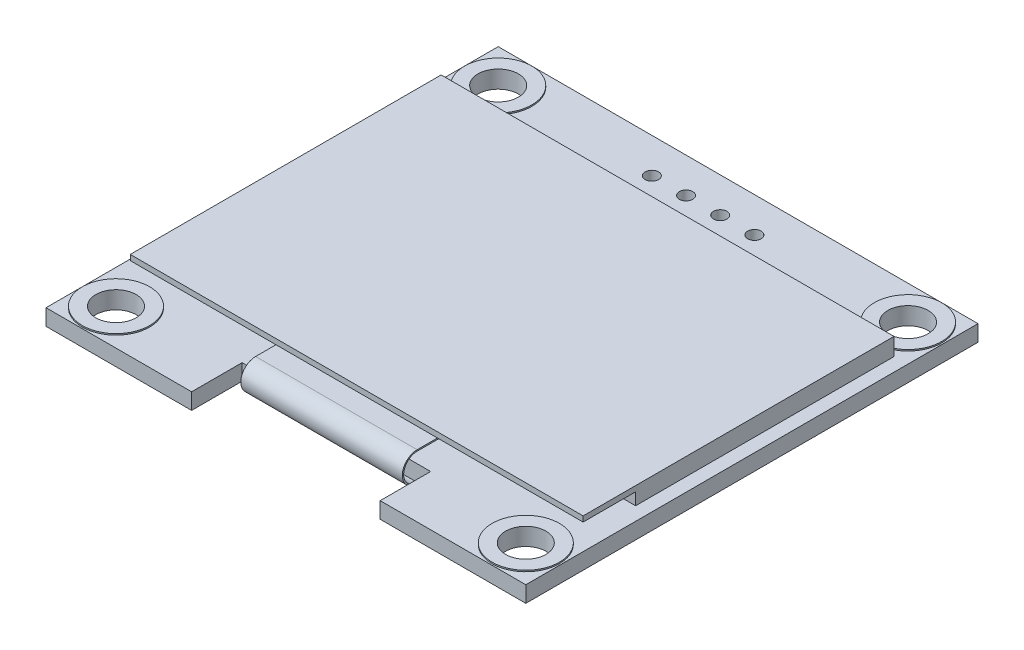
from build123d import *

# Parameters (mm, degrees)
CROQUIS1_R                     = 2.5
CROQUIS1_R_2                   = 0.5
SALIENTE_EXTRUIR1_DEPTH        = 1.2
SALIENTE_EXTRUIR2_DEPTH        = 0.1
SALIENTE_EXTRUIR2_DEPTH_BACK   = 1.2
CROQUIS2_R                     = 2.5
CROQUIS2_R_2                   = 1.5
SALIENTE_EXTRUIR2_2_DEPTH      = 0.1
SALIENTE_EXTRUIR2_2_DEPTH_BACK = 1.2
SALIENTE_EXTRUIR2_3_DEPTH      = 0.1
SALIENTE_EXTRUIR2_3_DEPTH_BACK = 1.2
SALIENTE_EXTRUIR2_4_DEPTH      = 0.1
SALIENTE_EXTRUIR2_4_DEPTH_BACK = 1.2
SALIENTE_EXTRUIR3_DEPTH        = 16.825
SALIENTE_EXTRUIR3_DEPTH_BACK   = 16.825
SALIENTE_EXTRUIR4_DEPTH        = 0.1
SALIENTE_EXTRUIR5_DEPTH        = 6
SALIENTE_EXTRUIR5_DEPTH_BACK   = 6


with BuildPart() as part:
    # Croquis1 → Saliente-Extruir1 (new body)
    with BuildSketch(Plane(origin=(0, 0, 0), x_dir=(1, 0, 0), z_dir=(0, 1, 0))):
        Polygon((-7.005, 0), (7.005, 0), (7.005, -3.75), (17.825, -3.75), (17.825, 29.85), (-17.825, 29.85), (-17.825, -3.75), (-7.005, -3.75), align=None)
        with Locations(Location((-15.225, 27.25, 0), (0, 0, 270))):
            Circle(CROQUIS1_R, mode=Mode.SUBTRACT)
        with Locations(Location((15.225, 27.25, 0), (0, 0, 270))):
            Circle(CROQUIS1_R, mode=Mode.SUBTRACT)
        with Locations(Location((-15.225, -1.15, 0), (0, 0, 270))):
            Circle(CROQUIS1_R, mode=Mode.SUBTRACT)
        with Locations(Location((15.225, -1.15, 0), (0, 0, 270))):
            Circle(CROQUIS1_R, mode=Mode.SUBTRACT)
        with Locations(Location((-1.27, 27.25, 0), (0, 0, 270))):
            Circle(CROQUIS1_R_2, mode=Mode.SUBTRACT)
        with Locations(Location((-3.81, 27.25, 0), (0, 0, 270))):
            Circle(CROQUIS1_R_2, mode=Mode.SUBTRACT)
        with Locations(Location((1.27, 27.25, 0), (0, 0, 270))):
            Circle(CROQUIS1_R_2, mode=Mode.SUBTRACT)
        with Locations(Location((3.81, 27.25, 0), (0, 0, 270))):
            Circle(CROQUIS1_R_2, mode=Mode.SUBTRACT)
    extrude(amount=SALIENTE_EXTRUIR1_DEPTH)


with BuildPart() as body_2:
    # Croquis2 → Saliente-Extruir2 (new, two sides: drawn at the far end of the back side and taken through both)
    with BuildSketch(Plane(origin=(0, 1.2, 0), x_dir=(1, 0, 0), z_dir=(0, 1, 0)).offset(-SALIENTE_EXTRUIR2_DEPTH_BACK)):
        with Locations(Location((-15.225, 27.25, 0), (0, 0, 270))):
            Circle(CROQUIS2_R)
        with Locations(Location((-15.225, 27.25, 0), (0, 0, 270))):
            Circle(CROQUIS2_R_2, mode=Mode.SUBTRACT)
    extrude(amount=SALIENTE_EXTRUIR2_DEPTH + SALIENTE_EXTRUIR2_DEPTH_BACK)


with BuildPart() as body_3:
    # Croquis2 → Saliente-Extruir2 2 (new, two sides: drawn at the far end of the back side and taken through both)
    with BuildSketch(Plane(origin=(0, 1.2, 0), x_dir=(1, 0, 0), z_dir=(0, 1, 0)).offset(-SALIENTE_EXTRUIR2_2_DEPTH_BACK)):
        with Locations(Location((15.225, 27.25, 0), (0, 0, 270))):
            Circle(CROQUIS2_R)
        with Locations(Location((15.225, 27.25, 0), (0, 0, 270))):
            Circle(CROQUIS2_R_2, mode=Mode.SUBTRACT)
    extrude(amount=SALIENTE_EXTRUIR2_2_DEPTH + SALIENTE_EXTRUIR2_2_DEPTH_BACK)


with BuildPart() as body_4:
    # Croquis2 → Saliente-Extruir2 3 (new, two sides: drawn at the far end of the back side and taken through both)
    with BuildSketch(Plane(origin=(0, 1.2, 0), x_dir=(1, 0, 0), z_dir=(0, 1, 0)).offset(-SALIENTE_EXTRUIR2_3_DEPTH_BACK)):
        with Locations(Location((-15.225, -1.15, 0), (0, 0, 270))):
            Circle(CROQUIS2_R)
        with Locations(Location((-15.225, -1.15, 0), (0, 0, 270))):
            Circle(CROQUIS2_R_2, mode=Mode.SUBTRACT)
    extrude(amount=SALIENTE_EXTRUIR2_3_DEPTH + SALIENTE_EXTRUIR2_3_DEPTH_BACK)


with BuildPart() as body_5:
    # Croquis2 → Saliente-Extruir2 4 (new, two sides: drawn at the far end of the back side and taken through both)
    with BuildSketch(Plane(origin=(0, 1.2, 0), x_dir=(1, 0, 0), z_dir=(0, 1, 0)).offset(-SALIENTE_EXTRUIR2_4_DEPTH_BACK)):
        with Locations(Location((15.225, -1.15, 0), (0, 0, 270))):
            Circle(CROQUIS2_R)
        with Locations(Location((15.225, -1.15, 0), (0, 0, 270))):
            Circle(CROQUIS2_R_2, mode=Mode.SUBTRACT)
    extrude(amount=SALIENTE_EXTRUIR2_4_DEPTH + SALIENTE_EXTRUIR2_4_DEPTH_BACK)


with BuildPart() as body_6:
    # Croquis3 → Saliente-Extruir3 (new, two sides: drawn at the far end of the back side and taken through both)
    with BuildSketch(Plane(origin=(0, 0, 0), x_dir=(0, 0, -1), z_dir=(1, 0, 0)).offset(-SALIENTE_EXTRUIR3_DEPTH_BACK)):
        Polygon((24.61, 1.2), (24.61, 2.5), (1.51, 2.5), (1.51, 2.1), (5.41, 2.1), (5.41, 1.2), align=None)
    extrude(amount=SALIENTE_EXTRUIR3_DEPTH + SALIENTE_EXTRUIR3_DEPTH_BACK)


with BuildPart() as body_7:
    # Croquis4 → Saliente-Extruir4 (new body)
    with BuildSketch(Plane.XZ):
        Polygon((11, -7), (-11, -7), (-11, -4), (-6, -2.55853536), (-6, 0), (6, 0), (6, -2.55853536), (11, -4), align=None)
    extrude(amount=SALIENTE_EXTRUIR4_DEPTH)

    # Croquis5 → Saliente-Extruir5 (add, two sides: drawn at the far end of the back side and taken through both)
    with BuildSketch(Plane(origin=(0, 0, 0), x_dir=(0, 0, -1), z_dir=(1, 0, 0)).offset(-SALIENTE_EXTRUIR5_DEPTH_BACK)):
        with BuildLine():
            Line((1.51, 2.1), (3.068443588, 2.1))
            Line((3.068443588, 2.1), (3.068443588, 2))
            Line((3.068443588, 2), (1.51, 2))
            Line((1.51, 2), (0, 2))
            ThreePointArc((0, 2), (-1, 1), (0, 0))
            Line((0, 0), (0, -0.1))
            ThreePointArc((0, -0.1), (-1.1, 1), (0, 2.1))
            Line((0, 2.1), (1.51, 2.1))
        make_face()
    extrude(amount=SALIENTE_EXTRUIR5_DEPTH + SALIENTE_EXTRUIR5_DEPTH_BACK)


solid = Compound([part.part, body_2.part, body_3.part, body_4.part, body_5.part, body_6.part, body_7.part])
